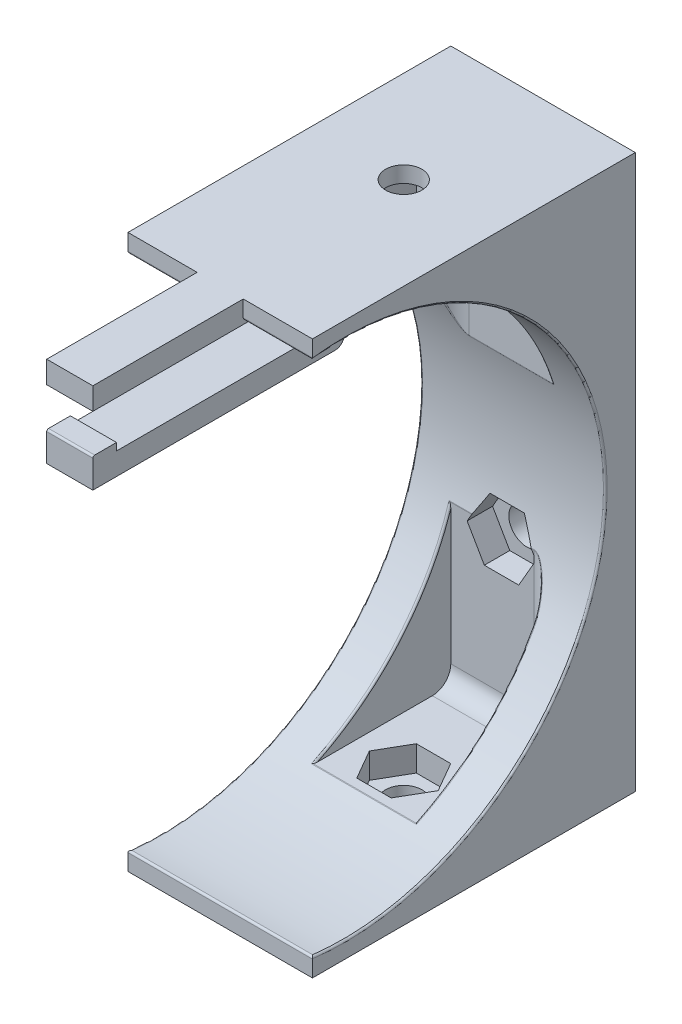
from build123d import *

# Parameters (mm, degrees)
SKETCH1_W               = 25.4
SKETCH1_H               = 76.2
BOSS_EXTRUDE1_DEPTH     = 44.45
SHELL1_T                = -5.715
CUT_EXTRUDE3_DEPTH      = 64.816710194
CUT_EXTRUDE3_DEPTH_BACK = 64.816710194
CUT_EXTRUDE4_DEPTH      = 90.126497182
CUT_EXTRUDE4_DEPTH_BACK = 90.126497182
SKETCH4_R               = 2.5
CUT_EXTRUDE5_DEPTH      = 56.796955338
CUT_EXTRUDE5_DEPTH_BACK = 56.796955338
SKETCH5_R               = 2.5
FILLET1_R               = 2.54
FILLET2_R               = 0.254
SKETCH7_R               = 2.5
CUT_EXTRUDE6_DEPTH      = 3.5
SKETCH8_R               = 2.5
CUT_EXTRUDE7_DEPTH      = 3.5
CUT_EXTRUDE8_START      = -3.5
SKETCH9_R               = 2.5
CUT_EXTRUDE8_DEPTH      = 3.5
SKETCH10_W              = 2.54
SKETCH10_H              = 6.35
BOSS_EXTRUDE2_DEPTH     = 3.175


with BuildPart() as part:
    # Sketch1 → Boss-Extrude1 (new body)
    with BuildSketch(Plane.XY):
        Rectangle(SKETCH1_W, SKETCH1_H)
    extrude(amount=BOSS_EXTRUDE1_DEPTH)

    # Shell1
    shell1_openings = [part.faces().sort_by_distance(p)[0] for p in [
        (0, 0, 44.45),
    ]]
    offset(amount=SHELL1_T, openings=shell1_openings, kind=Kind.INTERSECTION)

    # Sketch2 → Cut-Extrude3 (cut, two sides: drawn at the far end of the back side and taken through both)
    with BuildSketch(Plane(origin=(12.7, 0, 0), x_dir=(0, 0, -1), z_dir=(1, 0, 0)).offset(-CUT_EXTRUDE3_DEPTH_BACK)):
        with BuildLine():
            ThreePointArc((-36.413720818, -35.664362817), (-4.128213539, 0), (-36.413720818, 35.664362817))
            Line((-36.413720818, 35.664362817), (-36.413720818, -35.664362817))
        make_face()
        with BuildLine():
            Line((-36.413720818, -35.664362817), (-36.413720818, 35.664362817))
            ThreePointArc((-36.413720818, 35.664362817), (-40.434794926, 35.838148814), (-44.45, 35.56))
            Line((-44.45, 35.56), (-44.45, -35.56))
            ThreePointArc((-44.45, -35.56), (-40.434794926, -35.838148814), (-36.413720818, -35.664362817))
        make_face()
    extrude(amount=CUT_EXTRUDE3_DEPTH + CUT_EXTRUDE3_DEPTH_BACK, mode=Mode.SUBTRACT)

    # Sketch4 → Cut-Extrude4 (cut, two sides: drawn at the far end of the back side and taken through both)
    with BuildSketch(Plane(origin=(0, 38.1, 0), x_dir=(1, 0, 0), z_dir=(0, 1, 0)).offset(-CUT_EXTRUDE4_DEPTH_BACK)):
        with Locations(Location((0, -19.177, 0), (0, 0, 270))):
            Circle(SKETCH4_R)
    extrude(amount=CUT_EXTRUDE4_DEPTH + CUT_EXTRUDE4_DEPTH_BACK, mode=Mode.SUBTRACT)

    # Sketch5 → Cut-Extrude5 (cut, two sides: drawn at the far end of the back side and taken through both)
    with BuildSketch(Plane.XY.offset(5.715).offset(-CUT_EXTRUDE5_DEPTH_BACK)):
        with Locations((0, -11.684)):
            Circle(SKETCH5_R)
    extrude(amount=CUT_EXTRUDE5_DEPTH + CUT_EXTRUDE5_DEPTH_BACK, mode=Mode.SUBTRACT)

    # Fillet1
    fillet1_edges = [part.edges().sort_by_distance(p)[0] for p in [
        (6.985, -21.465702955, 5.715),
        (0, 32.385, 5.715),
        (-6.985, 21.465702955, 5.715),
        (0, -32.385, 5.715),
    ]]
    fillet(fillet1_edges, radius=FILLET1_R)

    # Fillet2
    fillet2_edges = [part.edges().sort_by_distance(p)[0] for p in [
        (-6.985, -23.45347117, 12.867277174),
        (0, -32.385, 24.613561487),
        (6.985, -25.868117579, 15.161522376),
        (6.985, 23.45347117, 12.867277174),
        (0, 32.385, 24.613561487),
        (-6.985, 25.868117579, 15.161522376),
        (12.7, 0, 4.128213539),
        (0, 35.56, 44.45),
        (0, -35.56, 44.45),
        (-12.7, 0, 4.128213539),
        (-4.605590257, -10.546405909, 5.715),
        (0, -9.184, 5.32485132),
        (1.27, 10.546405909, 5.715),
        (3.335590257, -10.546405909, 5.715),
        (6.453749337, -13.333029038, 6.700482035),
        (-6.453749331, 13.333029041, 6.700482036),
    ]]
    fillet(fillet2_edges, radius=FILLET2_R)

    # Sketch7 → Cut-Extrude6 (cut)
    with BuildSketch(Plane(origin=(0, -32.385, 0), x_dir=(1, 0, 0), z_dir=(0, 1, 0))):
        Polygon((-2.367136104, -23.277), (2.367136104, -23.277), (4.734272207, -19.177), (2.367136104, -15.077), (-2.367136104, -15.077), (-4.734272207, -19.177), align=None)
        with Locations(Location((0, -19.177, 0), (0, 0, 270))):
            Circle(SKETCH7_R, mode=Mode.SUBTRACT)
    extrude(amount=-CUT_EXTRUDE6_DEPTH, mode=Mode.SUBTRACT)

    # Sketch8 → Cut-Extrude7 (cut)
    with BuildSketch(Plane.XY.offset(5.715)):
        Polygon((4.734272207, -11.684), (2.367136104, -7.584), (-2.367136104, -7.584), (-4.734272207, -11.684), (-2.367136104, -15.784), (2.367136104, -15.784), align=None)
        with Locations((0, -11.684)):
            Circle(SKETCH8_R, mode=Mode.SUBTRACT)
    extrude(amount=-CUT_EXTRUDE7_DEPTH, mode=Mode.SUBTRACT)

    # Sketch9 → Cut-Extrude8 (cut)
    with BuildSketch(Plane.XZ.offset(-32.385).offset(CUT_EXTRUDE8_START)):
        Polygon((2.367136104, 15.077), (4.734272207, 19.177), (2.367136104, 23.277), (-2.367136104, 23.277), (-4.734272207, 19.177), (-2.367136104, 15.077), align=None)
        with Locations(Location((0, 19.177, 0), (0, 0, 90))):
            Circle(SKETCH9_R, mode=Mode.SUBTRACT)
    extrude(amount=CUT_EXTRUDE8_DEPTH, mode=Mode.SUBTRACT)

    # Sketch10 → Boss-Extrude2 (add, symmetric)
    with BuildSketch(Plane(origin=(0, 0, 0), x_dir=(0, 0, -1), z_dir=(1, 0, 0))):
        Polygon((-30.529506667, 35.052), (-30.529506667, 38.1), (-65.157426577, 38.1), (-65.157426577, 35.052), (-33.069506667, 35.052), align=None)
        with Locations((-31.799506667, 31.877)):
            Rectangle(SKETCH10_W, SKETCH10_H)
        with BuildLine():
            Line((-30.529506667, 26.924), (-30.529506667, 28.702))
            Line((-30.529506667, 28.702), (-33.069506667, 28.702))
            Line((-33.069506667, 28.702), (-61.900873737, 28.702))
            Line((-61.900873737, 28.702), (-65.157426577, 28.702))
            Line((-65.157426577, 28.702), (-65.157426577, 25.654))
            Line((-65.157426577, 25.654), (-31.799506667, 25.654))
            ThreePointArc((-31.799506667, 25.654), (-30.901481055, 26.025974388), (-30.529506667, 26.924))
        make_face()
        with BuildLine():
            Line((-65.157426577, 28.702), (-61.900873737, 28.702))
            Line((-61.900873737, 28.702), (-61.900873737, 29.718))
            Line((-61.900873737, 29.718), (-64.903426577, 29.718))
            ThreePointArc((-64.903426577, 29.718), (-65.083031699, 29.643605122), (-65.157426577, 29.464))
            Line((-65.157426577, 29.464), (-65.157426577, 28.702))
        make_face()
    extrude(amount=BOSS_EXTRUDE2_DEPTH, both=True)


solid = part.part
